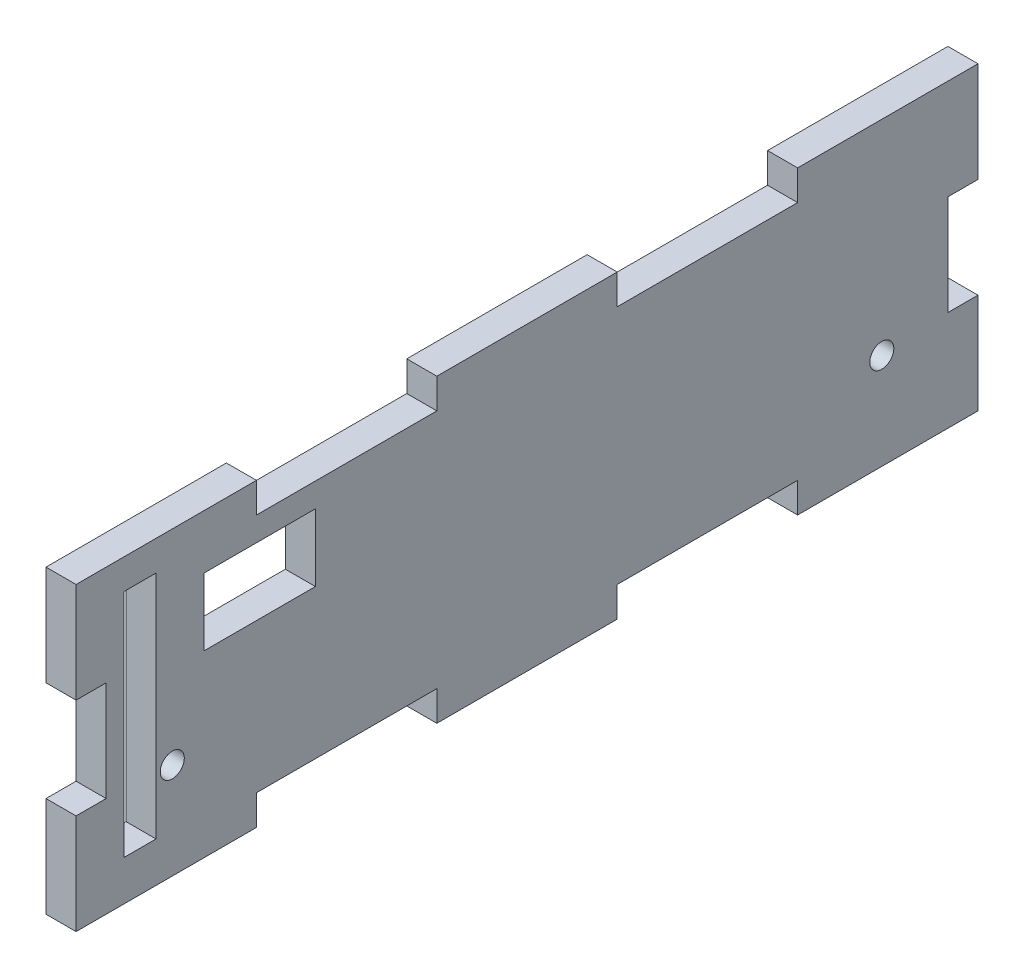
from build123d import *

# Parameters (mm, degrees)
CROQUIS1_R              = 2
SALIENTE_EXTRUIR1_DEPTH = 5
CROQUIS2_W              = 5.3
CROQUIS2_H              = 38.303523839
CROQUIS2_W_2            = 18.5
CROQUIS2_H_2            = 11.2
CORTAR_EXTRUIR1_DEPTH   = 10


with BuildPart() as part:
    # Croquis1 → Saliente-Extruir1 (new body)
    with BuildSketch(Plane(origin=(0, 0, 0), x_dir=(0, 0, -1), z_dir=(1, 0, 0))):
        Polygon((0, 33.333333333), (5, 33.333333333), (5, 16.666666667), (0, 16.666666667), (0, 0), (30, 0), (30, 5), (60, 5), (60, 0), (90, 0), (90, 5), (120, 5), (120, 0), (150, 0), (150, 16.666666667), (145, 16.666666667), (145, 33.333333333), (150, 33.333333333), (150, 50), (120, 50), (120, 45), (90, 45), (90, 50), (60, 50), (60, 45), (30, 45), (30, 50), (0, 50), align=None)
        with Locations((16, 16)):
            Circle(CROQUIS1_R, mode=Mode.SUBTRACT)
        with Locations(Location((134, 16, 0), (0, 0, 180))):
            Circle(CROQUIS1_R, mode=Mode.SUBTRACT)
    extrude(amount=SALIENTE_EXTRUIR1_DEPTH)

    # Croquis2 → Cortar-Extruir1 (cut)
    with BuildSketch(Plane(origin=(5, 0, 0), x_dir=(0, 0, -1), z_dir=(1, 0, 0))):
        with Locations((10.65, 25.84823808)):
            Rectangle(CROQUIS2_W, CROQUIS2_H)
        with Locations((30.55, 35.4)):
            Rectangle(CROQUIS2_W_2, CROQUIS2_H_2)
    extrude(amount=-CORTAR_EXTRUIR1_DEPTH, mode=Mode.SUBTRACT)


solid = part.part
